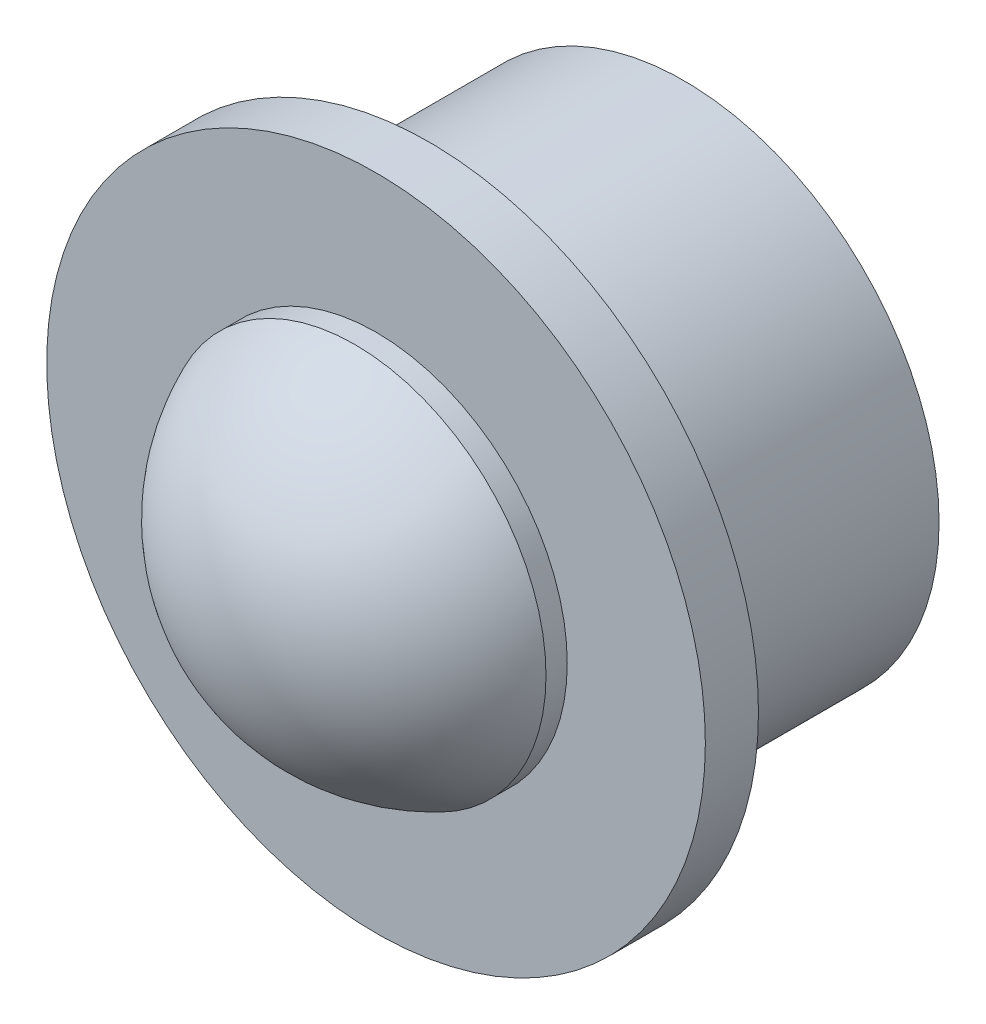
from build123d import *

# Parameters (mm, degrees)
ESQUISSE1_R       = 12
EXTRUSION1_DEPTH  = 12
ESQUISSE2_R       = 15.5
EXTRUSION2_DEPTH  = 2.5
ESQUISSE3_R       = 9
EXTRUSION3_DEPTH  = 1
D_ME1_FACE_RADIUS = 9
D_ME1_HEIGHT      = 6


with BuildPart() as part:
    # Esquisse1 → Extrusion1 (new body)
    with BuildSketch(Plane.XY):
        Circle(ESQUISSE1_R)
    extrude(amount=EXTRUSION1_DEPTH)

    # Esquisse2 → Extrusion2 (add)
    with BuildSketch(Plane.XY.offset(12)):
        Circle(ESQUISSE2_R)
    extrude(amount=EXTRUSION2_DEPTH)

    # Esquisse3 → Extrusion3 (add)
    with BuildSketch(Plane.XY.offset(14.5)):
        Circle(ESQUISSE3_R)
    extrude(amount=EXTRUSION3_DEPTH)

    # Dôme1: a dome of height H over a round flat face of radius A is a cap of a sphere of radius (A * A + H * H) / (2 * H)
    d_me1_r = (D_ME1_FACE_RADIUS * D_ME1_FACE_RADIUS + D_ME1_HEIGHT * D_ME1_HEIGHT) / (2 * D_ME1_HEIGHT)
    d_me1_base = Plane((0, 0, 15.5), z_dir=(0, 0, 1))
    with Locations(d_me1_base.offset(D_ME1_HEIGHT - d_me1_r)):
        d_me1_ball = Sphere(d_me1_r, mode=Mode.PRIVATE)
    add(split(d_me1_ball, bisect_by=d_me1_base, keep=Keep.TOP, mode=Mode.PRIVATE))


solid = part.part
